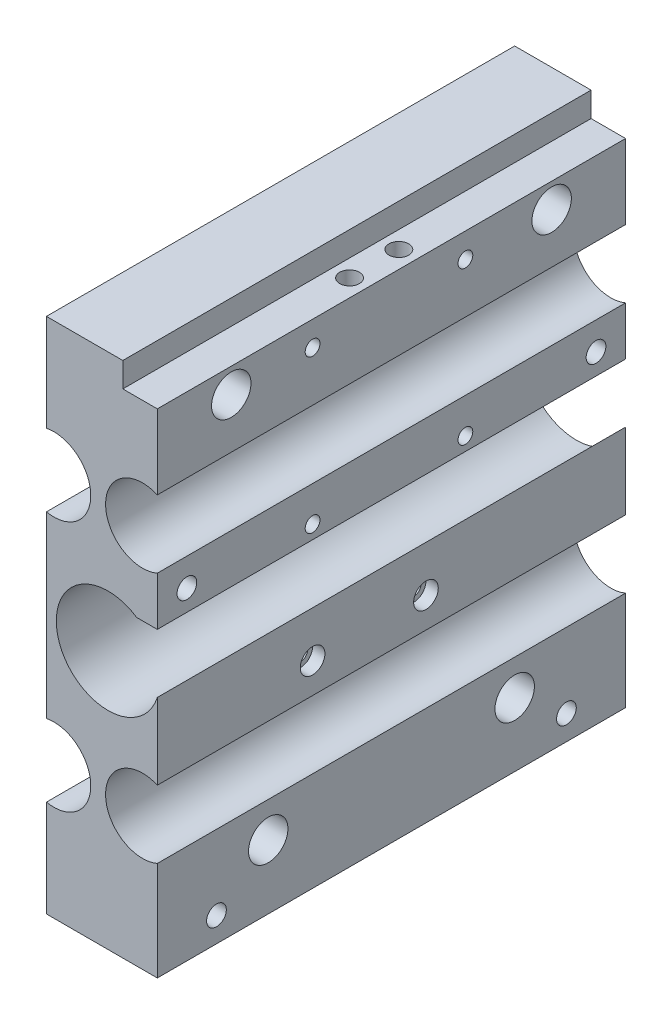
from build123d import *

# Parameters (mm, degrees)
BOSS_EXTRUDE1_DEPTH         = 95
SKETCH17_W                  = 95
SKETCH17_H                  = 105
BOSS_EXTRUDE3_DEPTH         = 7.5
SKETCH18_R                  = 7.5
CUT_EXTRUDE3_DEPTH          = 143.390308659
ESQUISSE1_R                 = 2
ENL_V_MAT_EXTRU_1_DEPTH     = 144.374509589
ESQUISSE3_R                 = 2
ENL_V_MAT_EXTRU_3_DEPTH     = 144.374509589
ESQUISSE4_R                 = 7.5
ESQUISSE4_R_2               = 10.5
ENL_V_MAT_EXTRU_4_DEPTH     = 143.390308659
ESQUISSE5_R                 = 4
ENL_V_MAT_EXTRU_15CNC_DEPTH = 144.374509589
ESQUISSE6_R                 = 1.5
ENL_V_MAT_EXTRU_19_DEPTH    = 144.374509589
ESQUISSE8_R                 = 2
ENL_V_MAT_EXTRU_20_DEPTH    = 15
ENL_V_START                 = -10
ESQUISSE8_3_R               = 3
ESQUISSE8_3_R_2             = 2
ENL_V_MAT_EXTRU_21_DEPTH    = 10
ESQUISSE9_R                 = 2.5
ENL_V_MAT_EXTRU_22_DEPTH    = 2.5


with BuildPart() as part:
    # Sketch1 → Boss-Extrude1 (new body)
    with BuildSketch(Plane.XY):
        Polygon((0, 0), (8, 0), (8, -5), (15, -5), (15, -9.75), (15, -24.75), (15, -43.75), (7, -43.75), (7, -53.25), (15, -53.25), (15, -60.75), (15, -105), (0, -105), align=None)
    extrude(amount=BOSS_EXTRUDE1_DEPTH)

    # Sketch17 → Boss-Extrude3 (add)
    with BuildSketch(Plane.ZY):
        with Locations((47.5, -52.5)):
            Rectangle(SKETCH17_W, SKETCH17_H)
    extrude(amount=BOSS_EXTRUDE3_DEPTH)

    # Sketch18 → Cut-Extrude3 (cut, through all)
    with BuildSketch(Plane.XY.offset(95)):
        with Locations((-6, -27)):
            Circle(SKETCH18_R)
        with Locations((-6, -78)):
            Circle(SKETCH18_R)
    extrude(amount=-CUT_EXTRUDE3_DEPTH, mode=Mode.SUBTRACT)

    # Esquisse1 → Enlèv. mat.-Extru.1 (cut, through all)
    with BuildSketch(Plane(origin=(15, 0, 0), x_dir=(0, 0, -1), z_dir=(1, 0, 0))):
        with Locations((-83, -100)):
            Circle(ESQUISSE1_R)
        with Locations((-12, -100)):
            Circle(ESQUISSE1_R)
    extrude(amount=-ENL_V_MAT_EXTRU_1_DEPTH, mode=Mode.SUBTRACT)

    # Esquisse3 → Enlèv. mat.-Extru.3 (cut, through all)
    with BuildSketch(Plane(origin=(15, 0, 0), x_dir=(0, 0, -1), z_dir=(1, 0, 0))):
        with Locations((-6, -39.5)):
            Circle(ESQUISSE3_R)
        with Locations((-89, -39.5)):
            Circle(ESQUISSE3_R)
    extrude(amount=-ENL_V_MAT_EXTRU_3_DEPTH, mode=Mode.SUBTRACT)

    # Esquisse4 → Enlèv. mat.-Extru.4 (cut, through all)
    with BuildSketch(Plane(origin=(0, 0, 0), x_dir=(-1, 0, 0), z_dir=(0, 0, -1))):
        with Locations((-12, -78)):
            Circle(ESQUISSE4_R)
        with Locations((-12, -27)):
            Circle(ESQUISSE4_R)
        with Locations((-5, -52.5)):
            Circle(ESQUISSE4_R_2)
    extrude(amount=-ENL_V_MAT_EXTRU_4_DEPTH, mode=Mode.SUBTRACT)

    # Esquisse5 → Enlèv. mat.-Extru.15CNC (cut, through all)
    with BuildSketch(Plane(origin=(-7.5, 0, 0), x_dir=(0, 0, -1), z_dir=(1, 0, 0))):
        with Locations((-15, -10)):
            Circle(ESQUISSE5_R)
        with Locations((-80, -10)):
            Circle(ESQUISSE5_R)
        with Locations((-22.5, -92)):
            Circle(ESQUISSE5_R)
        with Locations((-72.5, -92)):
            Circle(ESQUISSE5_R)
    extrude(amount=ENL_V_MAT_EXTRU_15CNC_DEPTH, mode=Mode.SUBTRACT)

    # Esquisse6 → Enlèv. mat.-Extru.19 (cut, through all)
    with BuildSketch(Plane(origin=(15, 0, 0), x_dir=(0, 0, -1), z_dir=(1, 0, 0))):
        with Locations((-32.5, -10)):
            Circle(ESQUISSE6_R)
        with Locations((-63.5, -10)):
            Circle(ESQUISSE6_R)
        with Locations((-63.5, -41)):
            Circle(ESQUISSE6_R)
        with Locations((-32.5, -41)):
            Circle(ESQUISSE6_R)
        with Locations((-40.5, -65)):
            Circle(ESQUISSE6_R)
        with Locations((-63.5, -65)):
            Circle(ESQUISSE6_R)
    extrude(amount=-ENL_V_MAT_EXTRU_19_DEPTH, mode=Mode.SUBTRACT)

    # Esquisse8 → Enlèv. mat.-Extru.20 (cut)
    with BuildSketch(Plane(origin=(0, -5, 0), x_dir=(1, 0, 0), z_dir=(0, 1, 0))):
        with Locations((11.5, -42.5)):
            Circle(ESQUISSE8_R)
        with Locations((11.5, -52.5)):
            Circle(ESQUISSE8_R)
    extrude(amount=-ENL_V_MAT_EXTRU_20_DEPTH, mode=Mode.SUBTRACT)

    # Esquisse8<3> → Enlèv. mat.-Extru.21 (cut)
    # profile 1 of 2: a face of its own
    with BuildSketch(Plane(origin=(0, -5, 0), x_dir=(1, 0, 0), z_dir=(0, 1, 0)).offset(ENL_V_START)):
        with Locations((11.5, -42.5)):
            Circle(ESQUISSE8_3_R)
        with Locations((11.5, -42.5)):
            Circle(ESQUISSE8_3_R_2, mode=Mode.SUBTRACT)
    # profile 2 of 2: a face of its own
    with BuildSketch(Plane(origin=(0, -5, 0), x_dir=(1, 0, 0), z_dir=(0, 1, 0)).offset(ENL_V_START)):
        with Locations((11.5, -52.5)):
            Circle(ESQUISSE8_3_R)
        with Locations((11.5, -52.5)):
            Circle(ESQUISSE8_3_R_2, mode=Mode.SUBTRACT)
    extrude(amount=-ENL_V_MAT_EXTRU_21_DEPTH, mode=Mode.SUBTRACT)

    # Esquisse9 → Enlèv. mat.-Extru.22 (cut)
    with BuildSketch(Plane(origin=(15, 0, 0), x_dir=(0, 0, -1), z_dir=(1, 0, 0))):
        with Locations((-40.5, -65)):
            Circle(ESQUISSE9_R)
        with Locations((-63.5, -65)):
            Circle(ESQUISSE9_R)
    extrude(amount=-ENL_V_MAT_EXTRU_22_DEPTH, mode=Mode.SUBTRACT)


solid = part.part
